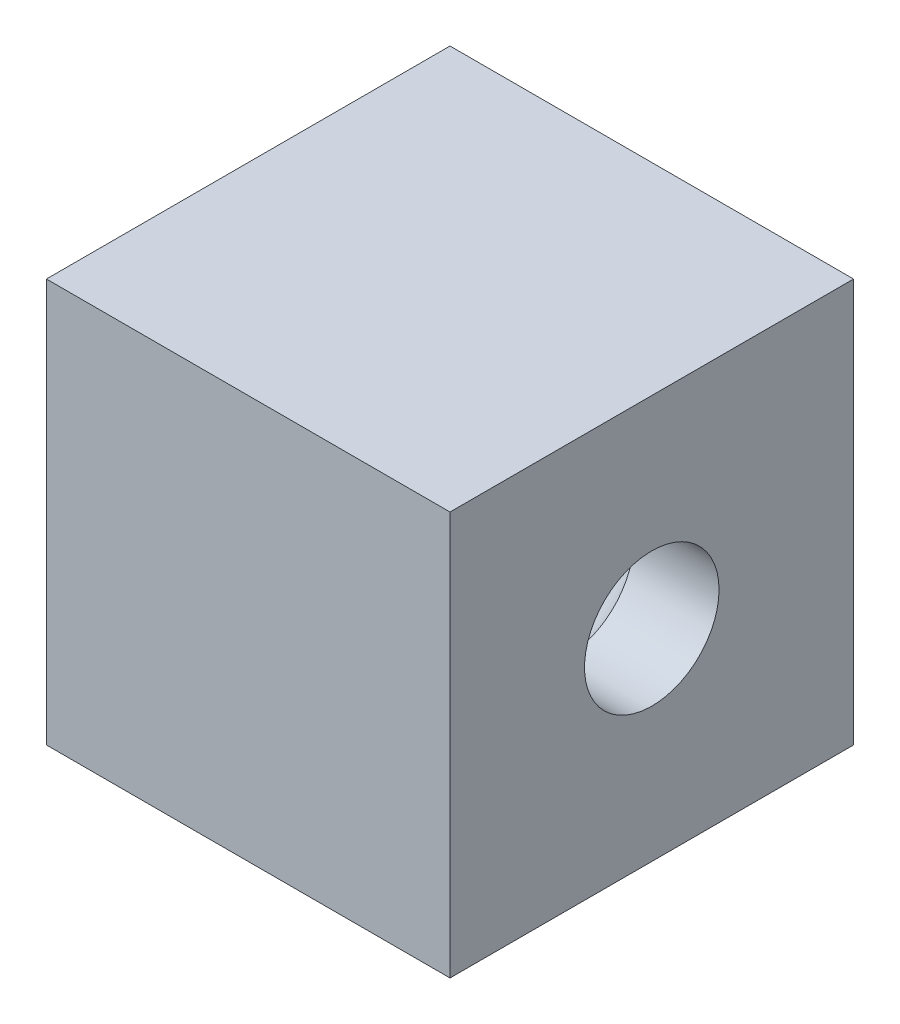
from build123d import *

# Parameters (mm, degrees)
SKETCH1_W           = 30
SKETCH1_H           = 30
BOSS_EXTRUDE1_DEPTH = 30
SKETCH2_R           = 5
CUT_EXTRUDE1_DEPTH  = 15


with BuildPart() as part:
    # Sketch1 → Boss-Extrude1 (new body)
    with BuildSketch(Plane(origin=(0, 0, 0), x_dir=(1, 0, 0), z_dir=(0, 1, 0))):
        with Locations((15, 15)):
            Rectangle(SKETCH1_W, SKETCH1_H)
    extrude(amount=BOSS_EXTRUDE1_DEPTH)

    # Sketch2 → Cut-Extrude1 (cut)
    with BuildSketch(Plane(origin=(30, 0, 0), x_dir=(0, 0, -1), z_dir=(1, 0, 0))):
        with Locations((15, 15)):
            Circle(SKETCH2_R)
    extrude(amount=-CUT_EXTRUDE1_DEPTH, mode=Mode.SUBTRACT)

    # Sketch4 → Cut-Revolve1 (revolve, cut)
    with BuildSketch(Plane(origin=(15, 0, 0), x_dir=(0, 0, -1), z_dir=(1, 0, 0))):
        with BuildLine():
            Line((25, 15), (5, 15))
            ThreePointArc((5, 15), (15, 5), (25, 15))
        make_face()
    revolve(axis=Axis((15, 15, -25), (0, 0, 1)), mode=Mode.SUBTRACT)


solid = part.part
